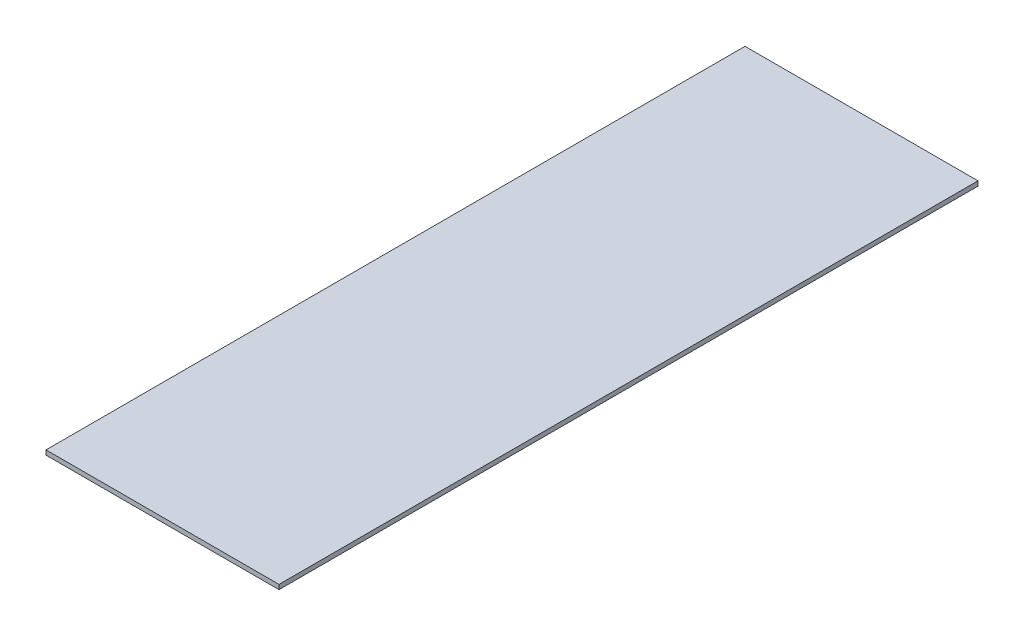
from build123d import *

# Parameters (mm, degrees)
SKETCH1_W           = 50.8
SKETCH1_H           = 152.4
BOSS_EXTRUDE1_DEPTH = 1


with BuildPart() as part:
    # Sketch1 → Boss-Extrude1 (new body)
    with BuildSketch(Plane(origin=(0, 0, 0), x_dir=(1, 0, 0), z_dir=(0, 1, 0))):
        with Locations((11.033819242, 55.761516035)):
            Rectangle(SKETCH1_W, SKETCH1_H)
    extrude(amount=BOSS_EXTRUDE1_DEPTH)


solid = part.part
